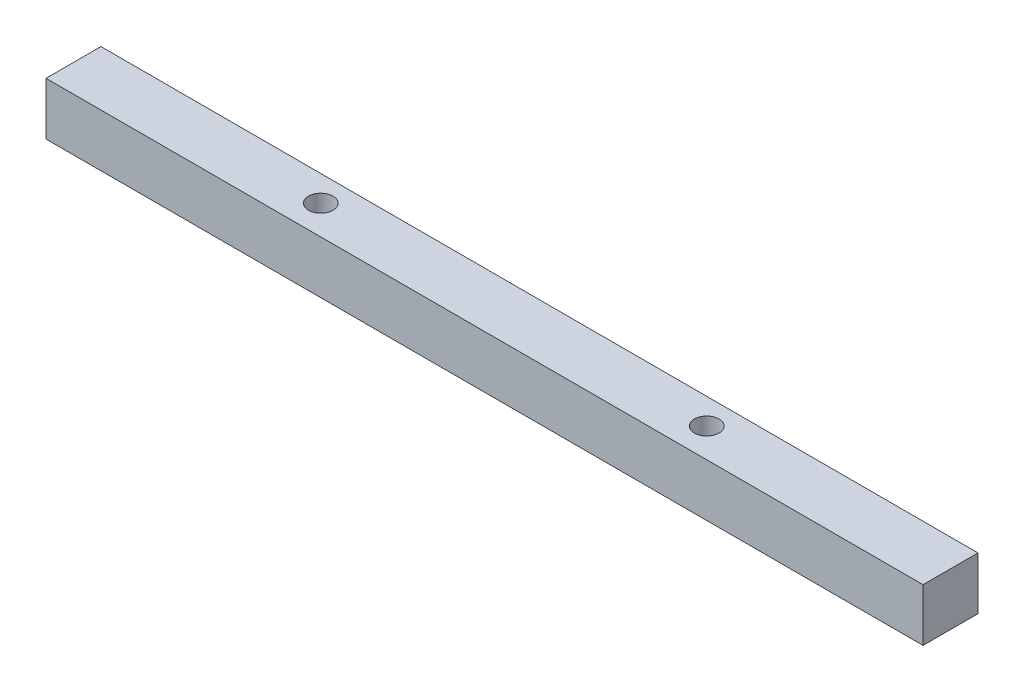
from build123d import *

# Parameters (mm, degrees)
SKETCH1_W               = 9.4
SKETCH1_H               = 9
BOSS_EXTRUDE1_DEPTH     = 150
CUT_EXTRUDE1_DEPTH      = 151.563474986
CUT_EXTRUDE1_DEPTH_BACK = 151.563474986
SKETCH2_R               = 2.1


with BuildPart() as part:
    # Sketch1 → Boss-Extrude1 (new body)
    with BuildSketch(Plane(origin=(0, 0, 0), x_dir=(0, 0, -1), z_dir=(1, 0, 0))):
        with Locations((4.7, 4.5)):
            Rectangle(SKETCH1_W, SKETCH1_H)
    extrude(amount=BOSS_EXTRUDE1_DEPTH)

    # Sketch2 → Cut-Extrude1 (cut, two sides: drawn at the far end of the back side and taken through both)
    with BuildSketch(Plane(origin=(0, 9, 0), x_dir=(1, 0, 0), z_dir=(0, 1, 0)).offset(-CUT_EXTRUDE1_DEPTH_BACK)):
        with Locations(Location((108, 4.998507463, 0), (0, 0, 270))):
            Circle(SKETCH2_R)
        with Locations(Location((42, 4.998507463, 0), (0, 0, 270))):
            Circle(SKETCH2_R)
    extrude(amount=CUT_EXTRUDE1_DEPTH + CUT_EXTRUDE1_DEPTH_BACK, mode=Mode.SUBTRACT)


solid = part.part
